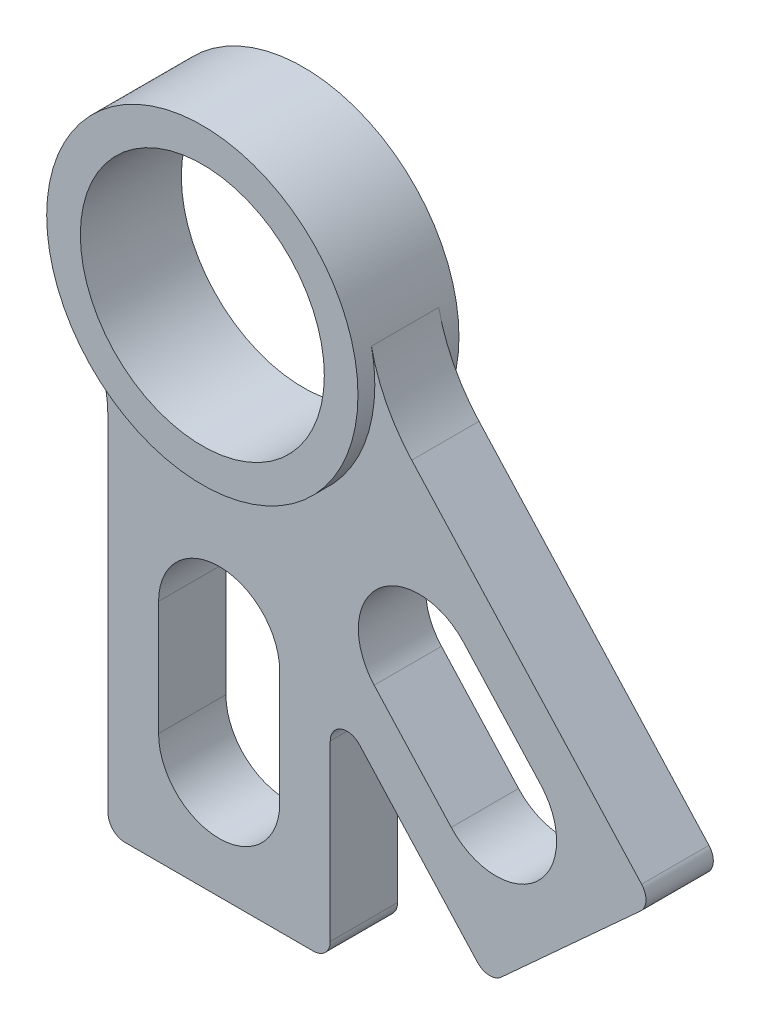
from build123d import *
from build123d.topology import SkipClean

# Parameters (mm, degrees)
SKETCH1_R           = 11.5062
BOSS_EXTRUDE1_DEPTH = 4.7625
CUT_EXTRUDE1_START  = 4.7625
CUT_EXTRUDE1_DEPTH  = 1.5875
CUT_EXTRUDE2_START  = -3.175
CUT_EXTRUDE2_DEPTH  = 1.5875
FILLET1_R           = 1.5875


with BuildPart() as part:
    # Sketch1 → Boss-Extrude1 (new, symmetric)
    # profile 1 of 2: a face of its own
    with BuildSketch(Plane.XY):
        with BuildLine():
            ThreePointArc((-12.661467165, -7.431344606), (5.301915083, -13.690410143), (14.364087476, 3.034901057))
            ThreePointArc((14.364087476, 3.034901057), (15.768494782, -0.923849067), (18.162007104, -4.375683536))
            Line((18.162007104, -4.375683536), (40.915153964, -29.346022579))
            Line((40.915153964, -29.346022579), (25.42603388, -43.459816684))
            Line((25.42603388, -43.459816684), (10.4775, -27.054615176))
            Line((10.4775, -27.054615176), (10.4775, -49.121968099))
            Line((10.4775, -49.121968099), (-10.4775, -49.121968099))
            Line((-10.4775, -49.121968099), (-10.4775, -15.466968099))
            ThreePointArc((-10.4775, -15.466968099), (-11.033218502, -11.303407199), (-12.661467165, -7.431344606))
        make_face()
        with BuildLine():
            ThreePointArc((23.067259929, -16.829899337), (14.993737878, -16.454810433), (14.618648975, -24.528332485))
            Line((14.618648975, -24.528332485), (21.889391392, -32.507576164))
            ThreePointArc((21.889391392, -32.507576164), (29.962913444, -32.882665067), (30.338002347, -24.809143016))
            Line((30.338002347, -24.809143016), (23.067259929, -16.829899337))
        make_face(mode=Mode.SUBTRACT)
        with BuildLine():
            ThreePointArc((5.715, -27.849468099), (0, -22.134468099), (-5.715, -27.849468099))
            Line((-5.715, -27.849468099), (-5.715, -38.644468099))
            ThreePointArc((-5.715, -38.644468099), (0, -44.359468099), (5.715, -38.644468099))
            Line((5.715, -38.644468099), (5.715, -27.849468099))
        make_face(mode=Mode.SUBTRACT)
    # profile 2 of 2: a face of its own
    with BuildSketch(Plane.XY):
        with BuildLine():
            ThreePointArc((14.364087476, 3.034901057), (-5.301915083, 13.690410143), (-12.661467165, -7.431344606))
            ThreePointArc((-12.661467165, -7.431344606), (5.301915083, -13.690410143), (14.364087476, 3.034901057))
        make_face()
        with Locations(Location((0, 0, 0), (0, 0, 180))):
            Circle(SKETCH1_R, mode=Mode.SUBTRACT)
    extrude(amount=BOSS_EXTRUDE1_DEPTH, both=True)

    # Sketch3 → Cut-Extrude1 (cut)
    with SkipClean():  # the faces are left unmerged after this step: merging them gives an invalid solid
        with BuildSketch(Plane.XY.offset(CUT_EXTRUDE1_START)):
            with BuildLine():
                ThreePointArc((-12.661467165, -7.431344606), (5.301915083, -13.690410143), (14.364087476, 3.034901057))
                ThreePointArc((14.364087476, 3.034901057), (15.768494782, -0.923849067), (18.162007104, -4.375683536))
                Line((18.162007104, -4.375683536), (40.915153964, -29.346022579))
                Line((40.915153964, -29.346022579), (25.42603388, -43.459816684))
                Line((25.42603388, -43.459816684), (10.4775, -27.054615176))
                Line((10.4775, -27.054615176), (10.4775, -49.121968099))
                Line((10.4775, -49.121968099), (-10.4775, -49.121968099))
                Line((-10.4775, -49.121968099), (-10.4775, -15.466968099))
                ThreePointArc((-10.4775, -15.466968099), (-11.033218502, -11.303407199), (-12.661467165, -7.431344606))
            make_face()
            with BuildLine():
                ThreePointArc((23.067259929, -16.829899337), (14.993737878, -16.454810433), (14.618648975, -24.528332485))
                Line((14.618648975, -24.528332485), (21.889391392, -32.507576164))
                ThreePointArc((21.889391392, -32.507576164), (29.962913444, -32.882665067), (30.338002347, -24.809143016))
                Line((30.338002347, -24.809143016), (23.067259929, -16.829899337))
            make_face(mode=Mode.SUBTRACT)
            with BuildLine():
                ThreePointArc((5.715, -27.849468099), (0, -22.134468099), (-5.715, -27.849468099))
                Line((-5.715, -27.849468099), (-5.715, -38.644468099))
                ThreePointArc((-5.715, -38.644468099), (0, -44.359468099), (5.715, -38.644468099))
                Line((5.715, -38.644468099), (5.715, -27.849468099))
            make_face(mode=Mode.SUBTRACT)
        extrude(amount=-CUT_EXTRUDE1_DEPTH, mode=Mode.SUBTRACT)

    # Sketch3<11> → Cut-Extrude2 (cut)
    with SkipClean():  # the faces are left unmerged after this step: merging them gives an invalid solid
        with BuildSketch(Plane.XY.offset(CUT_EXTRUDE2_START)):
            with BuildLine():
                ThreePointArc((-12.661467165, -7.431344606), (5.301915083, -13.690410143), (14.364087476, 3.034901057))
                ThreePointArc((14.364087476, 3.034901057), (15.768494782, -0.923849067), (18.162007104, -4.375683536))
                Line((18.162007104, -4.375683536), (40.915153964, -29.346022579))
                Line((40.915153964, -29.346022579), (25.42603388, -43.459816684))
                Line((25.42603388, -43.459816684), (10.4775, -27.054615176))
                Line((10.4775, -27.054615176), (10.4775, -49.121968099))
                Line((10.4775, -49.121968099), (-10.4775, -49.121968099))
                Line((-10.4775, -49.121968099), (-10.4775, -15.466968099))
                ThreePointArc((-10.4775, -15.466968099), (-11.033218502, -11.303407199), (-12.661467165, -7.431344606))
            make_face()
            with BuildLine():
                ThreePointArc((23.067259929, -16.829899337), (14.993737878, -16.454810433), (14.618648975, -24.528332485))
                Line((14.618648975, -24.528332485), (21.889391392, -32.507576164))
                ThreePointArc((21.889391392, -32.507576164), (29.962913444, -32.882665067), (30.338002347, -24.809143016))
                Line((30.338002347, -24.809143016), (23.067259929, -16.829899337))
            make_face(mode=Mode.SUBTRACT)
            with BuildLine():
                ThreePointArc((5.715, -27.849468099), (0, -22.134468099), (-5.715, -27.849468099))
                Line((-5.715, -27.849468099), (-5.715, -38.644468099))
                ThreePointArc((-5.715, -38.644468099), (0, -44.359468099), (5.715, -38.644468099))
                Line((5.715, -38.644468099), (5.715, -27.849468099))
            make_face(mode=Mode.SUBTRACT)
        extrude(amount=-CUT_EXTRUDE2_DEPTH, mode=Mode.SUBTRACT)

    # Fillet1
    fillet1_edges = [part.edges().sort_by_distance(p)[0] for p in [
        (40.915153964, -29.346022579, 0),
        (25.42603388, -43.459816684, 0),
        (10.4775, -27.054615176, 0),
        (10.4775, -49.121968099, 0),
        (-10.4775, -49.121968099, 0),
    ]]
    fillet(fillet1_edges, radius=FILLET1_R)


solid = part.part
